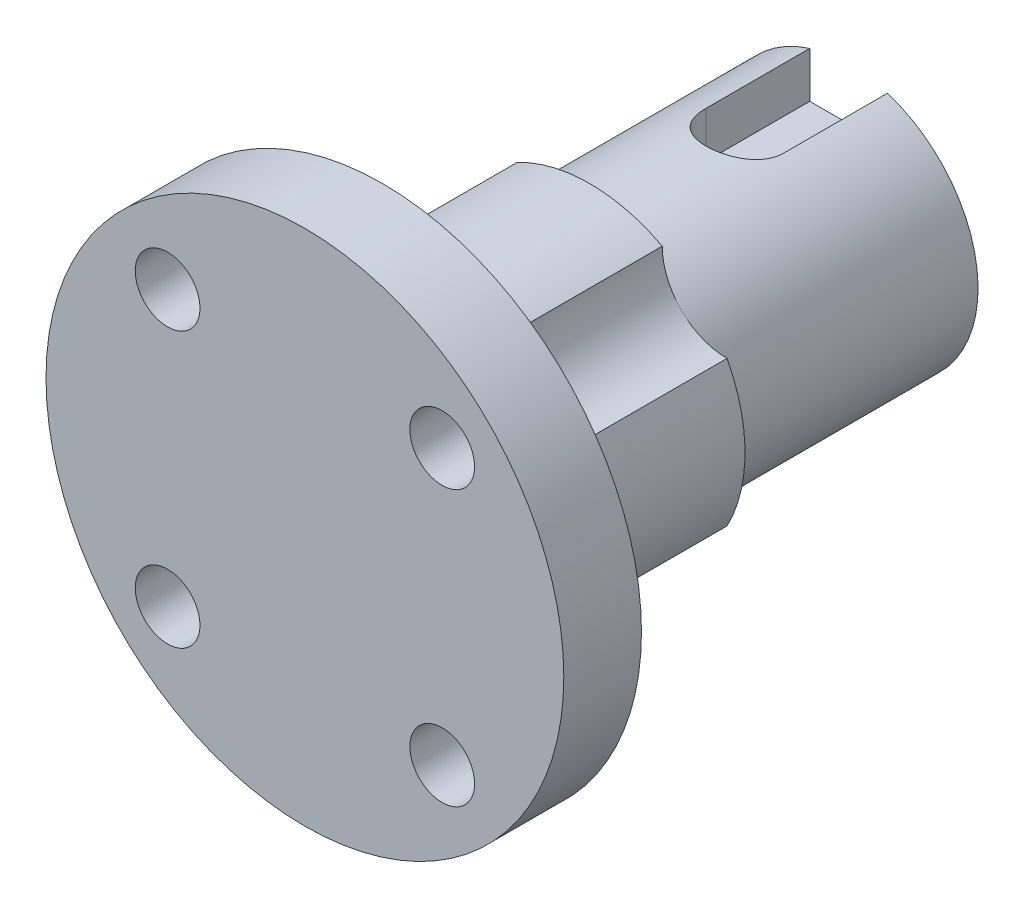
from build123d import *

# Parameters (mm, degrees)
SKETCH_1_R          = 5
EXTRUDE_1_DEPTH     = 10
CUT_EXTRUDE_1_DEPTH = 2
SKETCH_3_R          = 6
EXTRUDE_2_DEPTH     = 8
SKETCH_4_R          = 1.25
CUT_EXTRUDE_2_DEPTH = 10
SKETCH_6_R          = 10
EXTRUDE_3_DEPTH     = 3
CUT_EXTRUDE_4_REACH = 24.891
SKETCH_7_R          = 1.25
CUT_EXTRUDE_5_REACH = 24.891
SKETCH_11_R         = 2.5


with BuildPart() as part:
    # 草图1 → 凸台-拉伸1 (new body)
    with BuildSketch(Plane.XY):
        Circle(SKETCH_1_R)
    extrude(amount=EXTRUDE_1_DEPTH)

    # 草图2 → 切除-拉伸1 (cut)
    with BuildSketch(Plane(origin=(0, 5, 0), x_dir=(1, 0, 0), z_dir=(0, 1, 0))):
        with BuildLine():
            Line((-1.5, -4), (-1.5, 0))
            Line((-1.5, 0), (1.5, 0))
            Line((1.5, 0), (1.5, -4))
            ThreePointArc((1.5, -4), (0, -5.5), (-1.5, -4))
        make_face()
    extrude(amount=-CUT_EXTRUDE_1_DEPTH, mode=Mode.SUBTRACT)

    # 草图3 → 凸台-拉伸2 (add)
    with BuildSketch(Plane.XY.offset(10)):
        Circle(SKETCH_3_R)
    extrude(amount=EXTRUDE_2_DEPTH)

    # 草图4 → 切除-拉伸2 (cut)
    with BuildSketch(Plane(origin=(0, 0, 0), x_dir=(-1, 0, 0), z_dir=(0, 0, -1))):
        Circle(SKETCH_4_R)
    extrude(amount=-CUT_EXTRUDE_2_DEPTH, mode=Mode.SUBTRACT)

    # 草图6 → 凸台-拉伸3 (add)
    with BuildSketch(Plane.XY.offset(18)):
        Circle(SKETCH_6_R)
    extrude(amount=EXTRUDE_3_DEPTH)

    # 草图7 → 切除-拉伸4 (cut, up to next)
    with BuildSketch(Plane(origin=(0, 0, 18), x_dir=(-1, 0, 0), z_dir=(0, 0, -1)), mode=Mode.PRIVATE) as cut_extrude_4_sk1:
        with Locations((5.303300859, 5.303300859)):
            Circle(SKETCH_7_R)
    cut_extrude_4_tool1 = extrude(cut_extrude_4_sk1.sketch, amount=-CUT_EXTRUDE_4_REACH, mode=Mode.PRIVATE) & part.part
    # 草图7 → 切除-拉伸4 (cut, up to next)
    with BuildSketch(Plane(origin=(0, 0, 18), x_dir=(-1, 0, 0), z_dir=(0, 0, -1)), mode=Mode.PRIVATE) as cut_extrude_4_sk2:
        with Locations((-5.303300859, 5.303300859)):
            Circle(SKETCH_7_R)
    cut_extrude_4_tool2 = extrude(cut_extrude_4_sk2.sketch, amount=-CUT_EXTRUDE_4_REACH, mode=Mode.PRIVATE) & part.part
    # 草图7 → 切除-拉伸4 (cut, up to next)
    with BuildSketch(Plane(origin=(0, 0, 18), x_dir=(-1, 0, 0), z_dir=(0, 0, -1)), mode=Mode.PRIVATE) as cut_extrude_4_sk3:
        with Locations((-5.303300859, -5.303300859)):
            Circle(SKETCH_7_R)
    cut_extrude_4_tool3 = extrude(cut_extrude_4_sk3.sketch, amount=-CUT_EXTRUDE_4_REACH, mode=Mode.PRIVATE) & part.part
    # 草图7 → 切除-拉伸4 (cut, up to next)
    with BuildSketch(Plane(origin=(0, 0, 18), x_dir=(-1, 0, 0), z_dir=(0, 0, -1)), mode=Mode.PRIVATE) as cut_extrude_4_sk4:
        with Locations((5.303300859, -5.303300859)):
            Circle(SKETCH_7_R)
    cut_extrude_4_tool4 = extrude(cut_extrude_4_sk4.sketch, amount=-CUT_EXTRUDE_4_REACH, mode=Mode.PRIVATE) & part.part
    add(cut_extrude_4_tool1.solids().sort_by_distance((-5.303301, 5.303301, 18))[0], mode=Mode.SUBTRACT)
    add(cut_extrude_4_tool2.solids().sort_by_distance((5.303301, 5.303301, 18))[0], mode=Mode.SUBTRACT)
    add(cut_extrude_4_tool3.solids().sort_by_distance((5.303301, -5.303301, 18))[0], mode=Mode.SUBTRACT)
    add(cut_extrude_4_tool4.solids().sort_by_distance((-5.303301, -5.303301, 18))[0], mode=Mode.SUBTRACT)

    # 草图11 → 切除-拉伸5 (cut, up to next)
    with BuildSketch(Plane(origin=(0, 0, 18), x_dir=(-1, 0, 0), z_dir=(0, 0, -1)), mode=Mode.PRIVATE) as cut_extrude_5_sk1:
        with Locations((5.303300859, 5.303300859)):
            Circle(SKETCH_11_R)
    cut_extrude_5_tool1 = extrude(cut_extrude_5_sk1.sketch, amount=CUT_EXTRUDE_5_REACH, mode=Mode.PRIVATE) & part.part
    # 草图11 → 切除-拉伸5 (cut, up to next)
    with BuildSketch(Plane(origin=(0, 0, 18), x_dir=(-1, 0, 0), z_dir=(0, 0, -1)), mode=Mode.PRIVATE) as cut_extrude_5_sk2:
        with Locations((-5.303300859, 5.303300859)):
            Circle(SKETCH_11_R)
    cut_extrude_5_tool2 = extrude(cut_extrude_5_sk2.sketch, amount=CUT_EXTRUDE_5_REACH, mode=Mode.PRIVATE) & part.part
    # 草图11 → 切除-拉伸5 (cut, up to next)
    with BuildSketch(Plane(origin=(0, 0, 18), x_dir=(-1, 0, 0), z_dir=(0, 0, -1)), mode=Mode.PRIVATE) as cut_extrude_5_sk3:
        with Locations((-5.303300859, -5.303300859)):
            Circle(SKETCH_11_R)
    cut_extrude_5_tool3 = extrude(cut_extrude_5_sk3.sketch, amount=CUT_EXTRUDE_5_REACH, mode=Mode.PRIVATE) & part.part
    # 草图11 → 切除-拉伸5 (cut, up to next)
    with BuildSketch(Plane(origin=(0, 0, 18), x_dir=(-1, 0, 0), z_dir=(0, 0, -1)), mode=Mode.PRIVATE) as cut_extrude_5_sk4:
        with Locations((5.303300859, -5.303300859)):
            Circle(SKETCH_11_R)
    cut_extrude_5_tool4 = extrude(cut_extrude_5_sk4.sketch, amount=CUT_EXTRUDE_5_REACH, mode=Mode.PRIVATE) & part.part
    add(cut_extrude_5_tool1.solids().sort_by_distance((-5.303301, 5.303301, 18))[0], mode=Mode.SUBTRACT)
    add(cut_extrude_5_tool2.solids().sort_by_distance((5.303301, 5.303301, 18))[0], mode=Mode.SUBTRACT)
    add(cut_extrude_5_tool3.solids().sort_by_distance((5.303301, -5.303301, 18))[0], mode=Mode.SUBTRACT)
    add(cut_extrude_5_tool4.solids().sort_by_distance((-5.303301, -5.303301, 18))[0], mode=Mode.SUBTRACT)


solid = part.part
